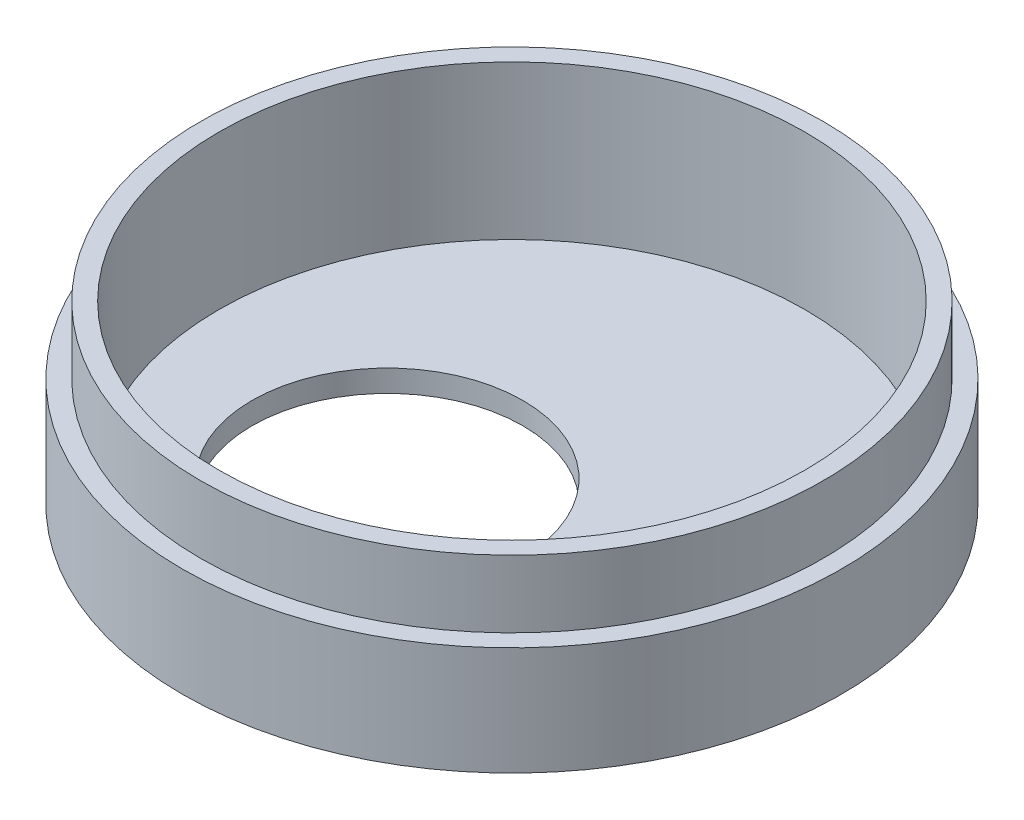
from build123d import *

# Parameters (mm, degrees)
CUT_EXTRUDE1_REACH  = 36.551
SKETCH2_R           = 22.225
SKETCH2_R_2         = 21.59
SKETCH3_R           = 9.398
CUT_EXTRUDE2_DEPTH  = 35.551469781
SKETCH5_R           = 20.955
SKETCH5_R_2         = 20.32
BOSS_EXTRUDE1_DEPTH = 10.668


with BuildPart() as part:
    # Sketch1 → Revolve1 (revolve)
    with BuildSketch(Plane.XY, mode=Mode.PRIVATE) as revolve1_sk:
        Polygon((22.86, 0), (22.86, -7.52475), (0, -7.52475), (0, -6.00075), (20.955, -6.00075), (20.955, 4.66725), (22.225, 4.66725), (22.225, 2.286), (21.59, 2.286), (21.59, 0), (22.225, 0), align=None)
    revolve(revolve1_sk.sketch.rotate(Axis((0, 33.267670174, 0), (0, -1, 0)), 90), axis=Axis((0, 33.267670174, 0), (0, -1, 0)))

    # Sketch2 → Cut-Extrude1 (cut, up to next)
    with BuildSketch(Plane(origin=(0, 4.66725, 0), x_dir=(1, 0, 0), z_dir=(0, 1, 0)), mode=Mode.PRIVATE) as cut_extrude1_sk1:
        Circle(SKETCH2_R)
        with Locations(Location((0, 0, 0), (0, 0, 270))):
            Circle(SKETCH2_R_2, mode=Mode.SUBTRACT)
    cut_extrude1_tool1 = extrude(cut_extrude1_sk1.sketch, amount=-CUT_EXTRUDE1_REACH, mode=Mode.PRIVATE) & part.part
    add(cut_extrude1_tool1.solids().sort_by_distance((-21.596382, 4.66725, 0))[0], mode=Mode.SUBTRACT)

    # Sketch3 → Cut-Extrude2 (cut, through all)
    with BuildSketch(Plane.XZ.offset(7.52475)):
        with Locations(Location((-4.318, 4.318, 0), (0, 0, 270))):
            Circle(SKETCH3_R)
    extrude(amount=-CUT_EXTRUDE2_DEPTH, mode=Mode.SUBTRACT)

    # Sketch5 → Boss-Extrude1 (add)
    with BuildSketch(Plane(origin=(0, 4.66725, 0), x_dir=(1, 0, 0), z_dir=(0, 1, 0))):
        Circle(SKETCH5_R)
        with Locations(Location((0, 0, 0), (0, 0, 270))):
            Circle(SKETCH5_R_2, mode=Mode.SUBTRACT)
    extrude(amount=-BOSS_EXTRUDE1_DEPTH)


solid = part.part
